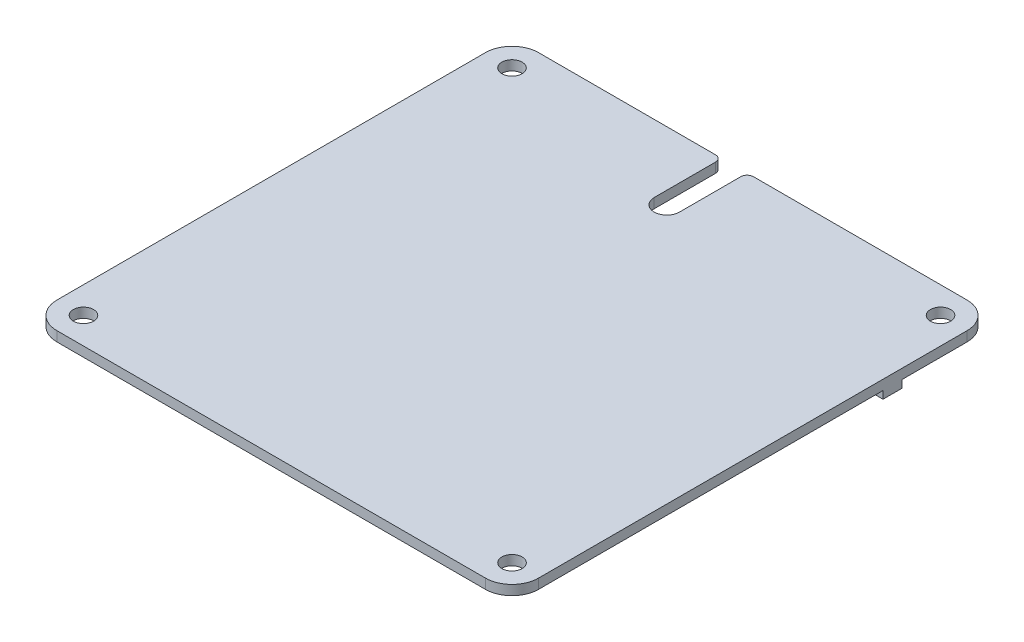
from build123d import *

# Parameters (mm, degrees)
BASE_PLATE_R    = 1.6
EXTRUDE_1_DEPTH = 1.55
FILLET_1_R      = 1
SKETCH_1_R      = 3.25
SKETCH_1_R_2    = 3.5
EXTRUDE_2_DEPTH = 4.5
SKETCH_1_3_R    = 2.4
EXTRUDE_3_DEPTH = 2
SKETCH_1_4_R    = 2.5
EXTRUDE_4_DEPTH = 1.2


with BuildPart() as part:
    # Base plate → 凸台-拉伸1 (new body)
    with BuildSketch(Plane(origin=(0, 0, 0), x_dir=(1, 0, 0), z_dir=(0, 1, 0))):
        with BuildLine():
            ThreePointArc((-38.1, -33.9), (-36.869848481, -36.869848481), (-33.9, -38.1))
            Line((-33.9, -38.1), (33.9, -38.1))
            ThreePointArc((33.9, -38.1), (36.869848481, -36.869848481), (38.1, -33.9))
            Line((38.1, -33.9), (38.1, 33.9))
            ThreePointArc((38.1, 33.9), (36.869848481, 36.869848481), (33.9, 38.1))
            Line((33.9, 38.1), (-0.9, 38.1))
            Line((-0.9, 38.1), (-0.9, 27.4))
            ThreePointArc((-0.9, 27.4), (-2.9, 25.4), (-4.9, 27.4))
            Line((-4.9, 27.4), (-4.9, 38.1))
            Line((-4.9, 38.1), (-33.9, 38.1))
            ThreePointArc((-33.9, 38.1), (-36.869848481, 36.869848481), (-38.1, 33.9))
            Line((-38.1, 33.9), (-38.1, -33.9))
        make_face()
        with Locations((-33.9, -33.9)):
            Circle(BASE_PLATE_R, mode=Mode.SUBTRACT)
        with Locations((33.9, -33.9)):
            Circle(BASE_PLATE_R, mode=Mode.SUBTRACT)
        with Locations((-33.9, 33.9)):
            Circle(BASE_PLATE_R, mode=Mode.SUBTRACT)
        with Locations((33.9, 33.9)):
            Circle(BASE_PLATE_R, mode=Mode.SUBTRACT)
    extrude(amount=EXTRUDE_1_DEPTH)

    # 圆角1
    fillet_1_edges = [part.edges().sort_by_distance(p)[0] for p in [
        (-4.9, 0.775, -38.1),
        (-0.9, 0.775, -38.1),
    ]]
    fillet(fillet_1_edges, radius=FILLET_1_R)

    # 草图1 → 凸台-拉伸2 (add)
    with BuildSketch(Plane.XZ):
        with Locations((-22.7, 23.9)):
            Circle(SKETCH_1_R)
        with Locations((-0.35, 10.415)):
            Circle(SKETCH_1_R)
        with Locations((-22.7, -3.07)):
            Circle(SKETCH_1_R)
        with Locations((-17.96, -15.36)):
            Circle(SKETCH_1_R_2)
        with Locations((-5.01, -15.36)):
            Circle(SKETCH_1_R_2)
    extrude(amount=EXTRUDE_2_DEPTH)

    # 草图1<3> → 凸台-拉伸3 (add)
    with BuildSketch(Plane.XZ):
        with BuildLine():
            Line((13.9, -7.4), (13.9, 2))
            ThreePointArc((13.9, 2), (11.4, 4.5), (8.9, 2))
            Line((8.9, 2), (8.9, -7.4))
            ThreePointArc((8.9, -7.4), (11.4, -9.9), (13.9, -7.4))
        make_face()
        with BuildLine():
            Line((26.6, -5.24), (26.6, -0.16))
            ThreePointArc((26.6, -0.16), (24.1, 2.34), (21.6, -0.16))
            Line((21.6, -0.16), (21.6, -5.24))
            ThreePointArc((21.6, -5.24), (24.1, -7.74), (26.6, -5.24))
        make_face()
        with Locations((16.7, -15.1)):
            Circle(SKETCH_1_3_R)
        with Locations((31.9, -15.1)):
            Circle(SKETCH_1_3_R)
    extrude(amount=EXTRUDE_3_DEPTH)

    # 草图1<4> → 凸台-拉伸4 (add)
    with BuildSketch(Plane.XZ):
        with BuildLine():
            Line((22.1, 14.09), (22.1, 21.71))
            ThreePointArc((22.1, 21.71), (19.6, 24.21), (17.1, 21.71))
            Line((17.1, 21.71), (17.1, 14.09))
            ThreePointArc((17.1, 14.09), (19.6, 11.59), (22.1, 14.09))
        make_face()
        with BuildLine():
            Line((38.1, -20.6), (30.8, -20.6))
            ThreePointArc((30.8, -20.6), (29.3, -22.1), (30.8, -23.6))
            Line((30.8, -23.6), (38.1, -23.6))
            Line((38.1, -23.6), (38.1, -20.6))
        make_face()
        with BuildLine():
            Line((26.65, -33.1), (26.65, -28.1))
            ThreePointArc((26.65, -28.1), (24.4, -25.85), (22.15, -28.1))
            Line((22.15, -28.1), (22.15, -33.1))
            ThreePointArc((22.15, -33.1), (24.4, -35.35), (26.65, -33.1))
        make_face()
        with BuildLine():
            Line((21.438912065, -26.051492297), (22.838912065, -23.051492297))
            ThreePointArc((22.838912065, -23.051492297), (21.751492297, -20.061087935), (18.761087935, -21.148507703))
            Line((18.761087935, -21.148507703), (17.361087935, -24.148507703))
            ThreePointArc((17.361087935, -24.148507703), (18.448507703, -27.138912065), (21.438912065, -26.051492297))
        make_face()
        with BuildLine():
            Line((21.65, -38.1), (21.65, -36.1))
            ThreePointArc((21.65, -36.1), (19.4, -33.85), (17.15, -36.1))
            Line((17.15, -36.1), (17.15, -38.1))
            Line((17.15, -38.1), (21.65, -38.1))
        make_face()
        with Locations((27.7, 17.9)):
            Circle(SKETCH_1_4_R)
    extrude(amount=EXTRUDE_4_DEPTH)


solid = part.part
